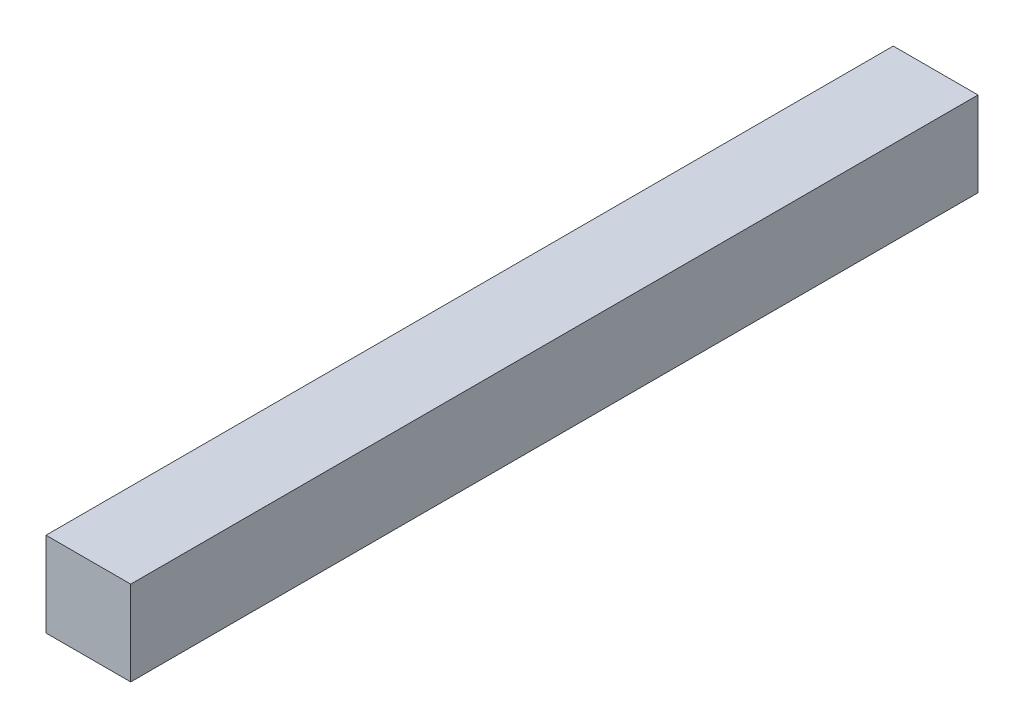
from build123d import *

# Parameters (mm, degrees)
SKETCH_1_W      = 20
SKETCH_1_H      = 20
EXTRUDE_1_DEPTH = 200


with BuildPart() as part:
    # 草图1 → 凸台-拉伸1 (new body)
    with BuildSketch(Plane.XY):
        with Locations((10, -10)):
            Rectangle(SKETCH_1_W, SKETCH_1_H)
    extrude(amount=EXTRUDE_1_DEPTH)


solid = part.part
